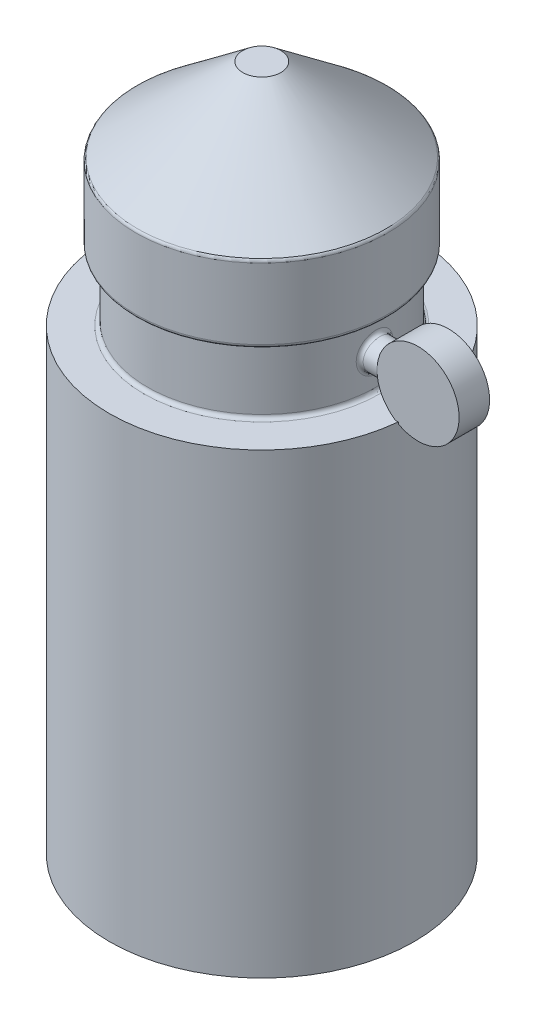
from build123d import *

# Parameters (mm, degrees)
SKETCH_2_R           = 4
EXTRUDE_1_DEPTH      = 35
EXTRUDE_2_DEPTH      = 4
EXTRUDE_2_DEPTH_BACK = 4
SKETCH_3_R           = 10.770329614
FILLET_3_R           = 1


with BuildPart() as part:
    # 草图1 → 旋转1 (revolve)
    with BuildSketch(Plane.XY):
        Polygon((0, 0), (5, 0), (33, -22), (33, -42), (30, -42), (30, -60), (40, -60), (40, -180), (0, -180), align=None)
    revolve(axis=Axis((0, -180, 0), (0, 1, 0)))

    # 草图2 → 凸台-拉伸1 (add)
    with BuildSketch(Plane(origin=(0, 0, 0), x_dir=(0, 0, -1), z_dir=(1, 0, 0))):
        with Locations((0, -51)):
            Circle(SKETCH_2_R)
    extrude(amount=EXTRUDE_1_DEPTH)

    # 草图3 → 凸台-拉伸2 (add, two sides: drawn at the far end of the back side and taken through both)
    with BuildSketch(Plane.XY.offset(-EXTRUDE_2_DEPTH_BACK)):
        with Locations((45, -51)):
            Circle(SKETCH_3_R)
    extrude(amount=EXTRUDE_2_DEPTH + EXTRUDE_2_DEPTH_BACK)

    # 圆角3
    fillet_3_edges = [part.edges().sort_by_distance(p)[0] for p in [
        (29.866368157, -48.17158234, -2.828436552),
        (-30, -60, 0),
        (-30, -42, 0),
        (-33, -22, 0),
        (-33, -42, 0),
    ]]
    fillet(fillet_3_edges, radius=FILLET_3_R)


solid = part.part
